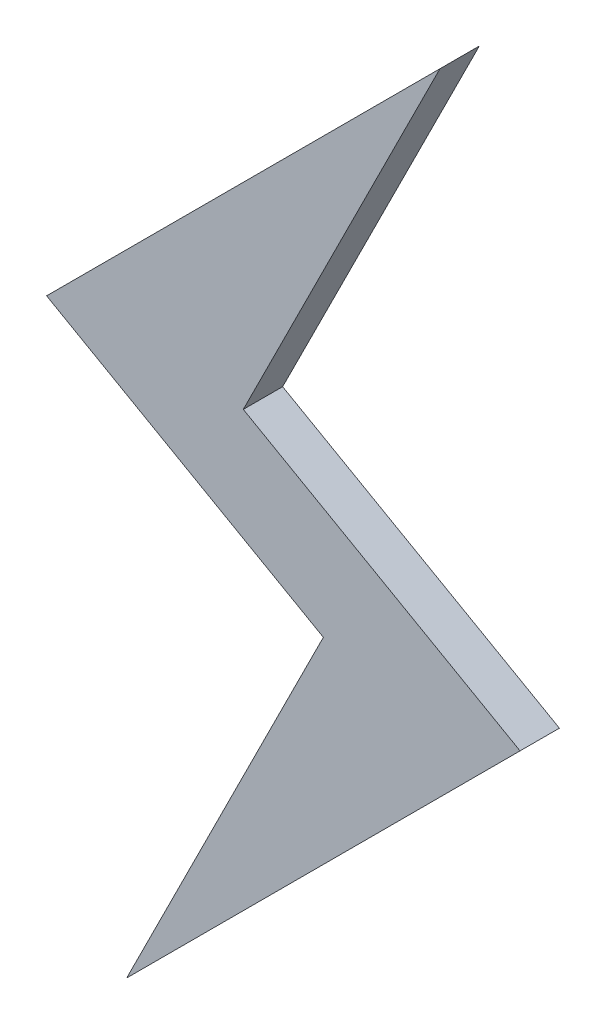
from build123d import *

# Parameters (mm, degrees)
EXTRUDE_1_DEPTH = 5


with BuildPart() as part:
    # 草图1 → 凸台-拉伸1 (new body)
    with BuildSketch(Plane.XY):
        Polygon((0, 0), (50, 50), (25, 0), (60.177155529, -20), (10.177155529, -70), (35.177155529, -20), align=None)
    extrude(amount=EXTRUDE_1_DEPTH)


solid = part.part
